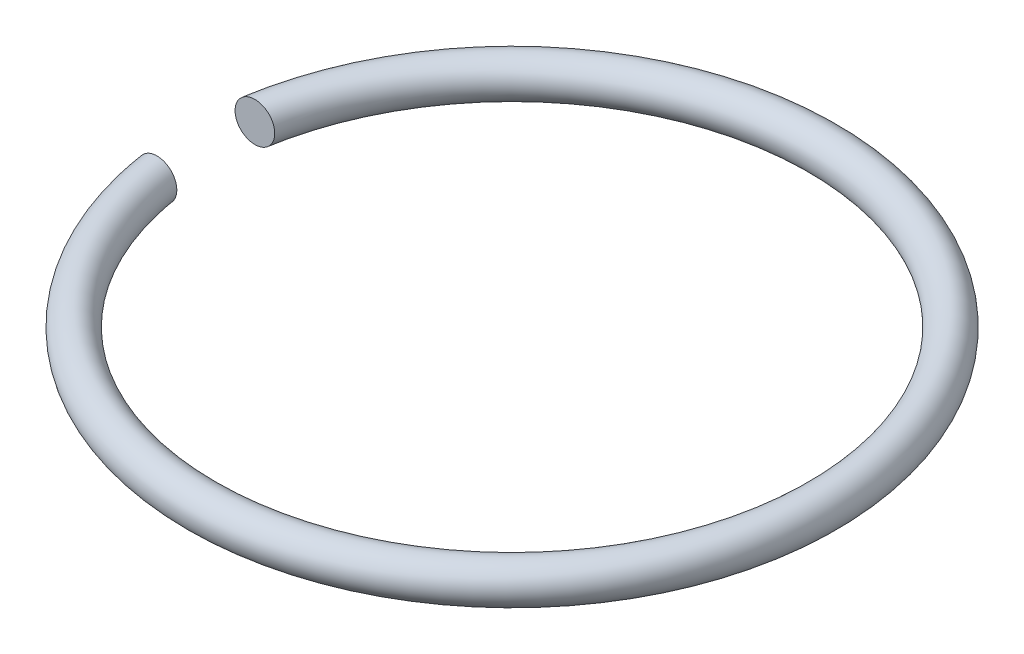
from build123d import *

# Parameters (mm, degrees)
SKETCH_1_R               = 0.6
CUT_EXTRUDE_1_DEPTH      = 15.296153474
CUT_EXTRUDE_1_DEPTH_BACK = 15.296153474
SKETCH_2_W               = 4.994748993
SKETCH_2_H               = 3


with BuildPart() as part:
    # Эскиз1 → Повернуть1 (revolve)
    with BuildSketch(Plane.XY, mode=Mode.PRIVATE) as revolve_1_sk:
        with Locations((-9.5, 0)):
            Circle(SKETCH_1_R)
    revolve(revolve_1_sk.sketch.rotate(Axis((0, 0, 0), (0, 1, 0)), 270), axis=Axis((0, 0, 0), (0, 1, 0)))

    # Эскиз2 → Вырез-Вытянуть1 (cut, two sides: drawn at the far end of the back side and taken through both)
    with BuildSketch(Plane(origin=(0, 0, 0), x_dir=(1, 0, 0), z_dir=(0, 1, 0)).offset(-CUT_EXTRUDE_1_DEPTH_BACK)):
        with Locations((-9.664623001, 0)):
            Rectangle(SKETCH_2_W, SKETCH_2_H)
    extrude(amount=CUT_EXTRUDE_1_DEPTH + CUT_EXTRUDE_1_DEPTH_BACK, mode=Mode.SUBTRACT)


solid = part.part
